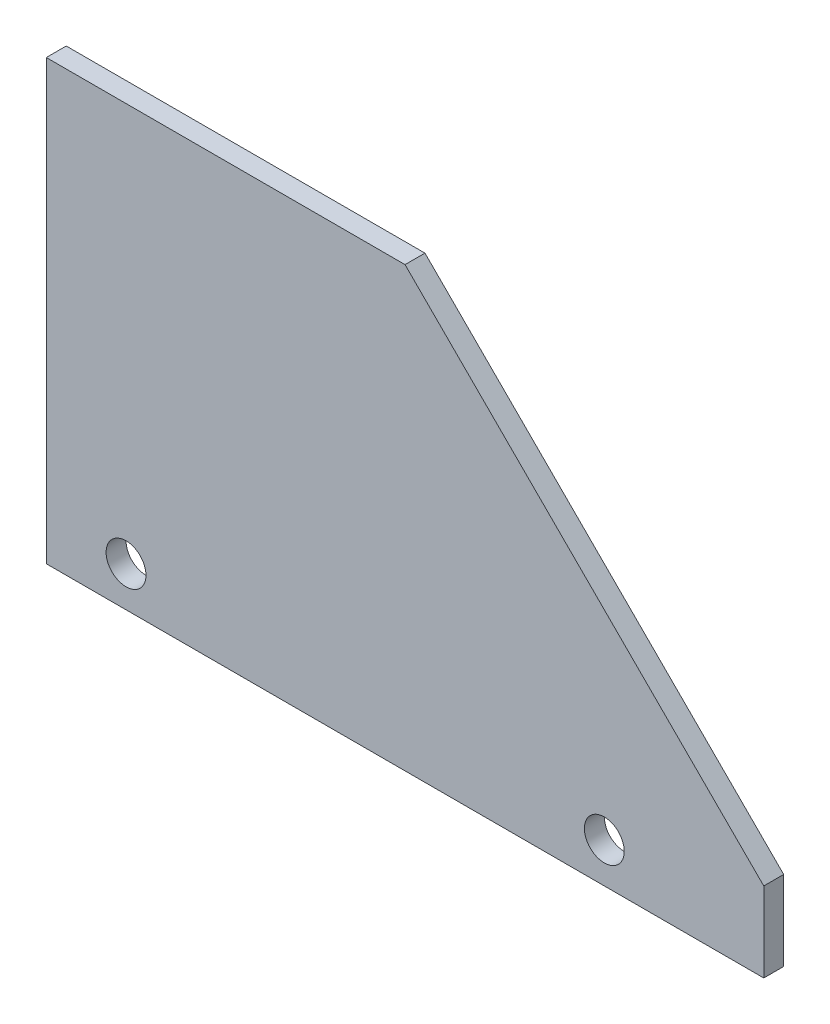
from build123d import *

# Parameters (mm, degrees)
BOSS_EXTRUDE1_DEPTH = 1.5875
SKETCH2_R           = 1.5875
CUT_EXTRUDE1_DEPTH  = 2.54
LPATTERN2_COUNT     = 2
LPATTERN2_PITCH     = 38.1
SKETCH3_W           = 6.35
SKETCH3_H           = 34.925
CUT_EXTRUDE2_DEPTH  = 2.54


with BuildPart() as part:
    # Sketch1 → Boss-Extrude1 (new body)
    with BuildSketch(Plane.XY):
        Polygon((0, 0), (0, 34.925), (34.925, 34.925), (63.5, 6.35), (63.5, 0), align=None)
    extrude(amount=BOSS_EXTRUDE1_DEPTH)

    # Sketch2 → Cut-Extrude1 (cut)
    with BuildSketch(Plane.XY.offset(1.5875)):
        with Locations((12.7, 3.175)):
            Circle(SKETCH2_R)
    cut_extrude1 = extrude(amount=-CUT_EXTRUDE1_DEPTH, mode=Mode.SUBTRACT)

    # LPattern2: Cut-Extrude1 ×2
    with Locations(*[(i * LPATTERN2_PITCH, 0, 0) for i in range(1, LPATTERN2_COUNT)]):
        add(cut_extrude1, mode=Mode.SUBTRACT)

    # Sketch3 → Cut-Extrude2 (cut)
    with BuildSketch(Plane.XY.offset(1.5875)):
        with Locations((3.175, 17.4625)):
            Rectangle(SKETCH3_W, SKETCH3_H)
    extrude(amount=-CUT_EXTRUDE2_DEPTH, mode=Mode.SUBTRACT)


solid = part.part
